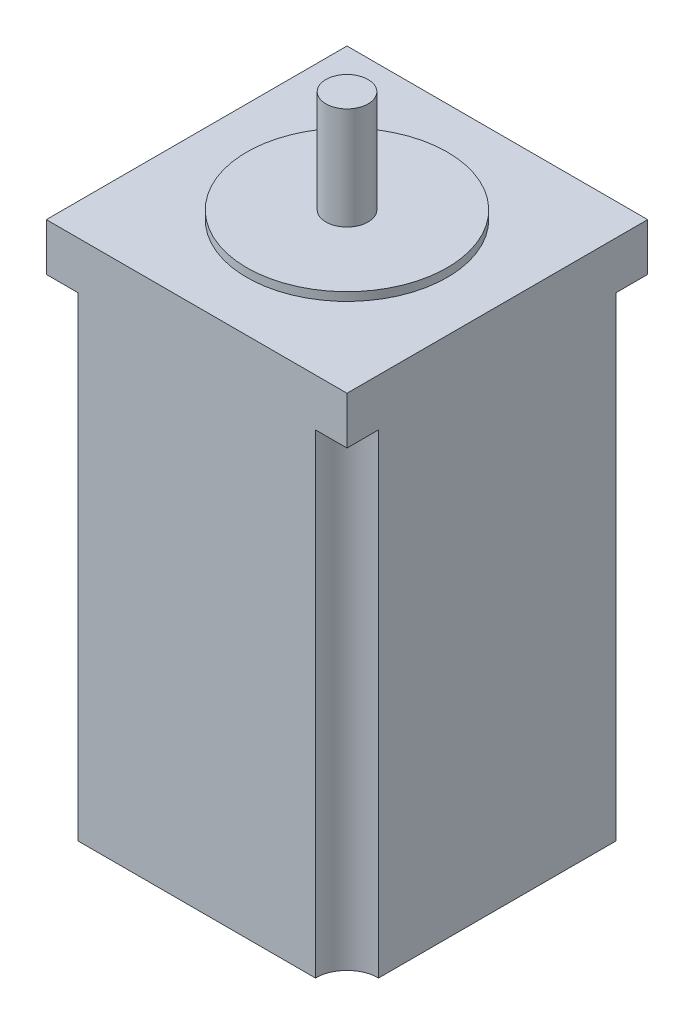
from build123d import *

# Parameters (mm, degrees)
SKETCH_1_W               = 57
SKETCH_1_H               = 57
EXTRUDE_1_DEPTH          = 99
CUT_EXTRUDE_1_DEPTH      = 90
SKETCH_3_R               = 4
EXTRUDE_2_DEPTH          = 21
PATTERN_CIRCULAR_1_COUNT = 4
SKETCH_5_R               = 19
EXTRUDE_3_DEPTH          = 1.6


with BuildPart() as part:
    # 草图1 → 凸台-拉伸1 (new body)
    with BuildSketch(Plane(origin=(0, 0, 0), x_dir=(1, 0, 0), z_dir=(0, 1, 0))):
        Rectangle(SKETCH_1_W, SKETCH_1_H)
    extrude(amount=EXTRUDE_1_DEPTH)

    # 草图2 → 切除-拉伸1 (cut)
    with BuildSketch(Plane.XZ):
        with BuildLine():
            Line((28.5, -28.5), (28.5, -22.5))
            ThreePointArc((28.5, -22.5), (24.257359313, -24.257359313), (22.5, -28.5))
            Line((22.5, -28.5), (28.5, -28.5))
        make_face()
    cut_extrude_1 = extrude(amount=-CUT_EXTRUDE_1_DEPTH, mode=Mode.SUBTRACT)

    # 草图3 → 凸台-拉伸2 (add)
    with BuildSketch(Plane(origin=(0, 99, 0), x_dir=(1, 0, 0), z_dir=(0, 1, 0))):
        Circle(SKETCH_3_R)
    extrude(amount=EXTRUDE_2_DEPTH)

    # 阵列(圆周)1: 切除-拉伸1 ×4 about axis
    pattern_circular_1_axis = Axis((0, 120, 0), (0, -1, 0))
    for i in range(1, PATTERN_CIRCULAR_1_COUNT):
        add(cut_extrude_1.rotate(pattern_circular_1_axis, i * 360 / PATTERN_CIRCULAR_1_COUNT), mode=Mode.SUBTRACT)

    # 草图5 → 凸台-拉伸3 (add)
    with BuildSketch(Plane(origin=(0, 99, 0), x_dir=(1, 0, 0), z_dir=(0, 1, 0))):
        Circle(SKETCH_5_R)
    extrude(amount=EXTRUDE_3_DEPTH)


solid = part.part
